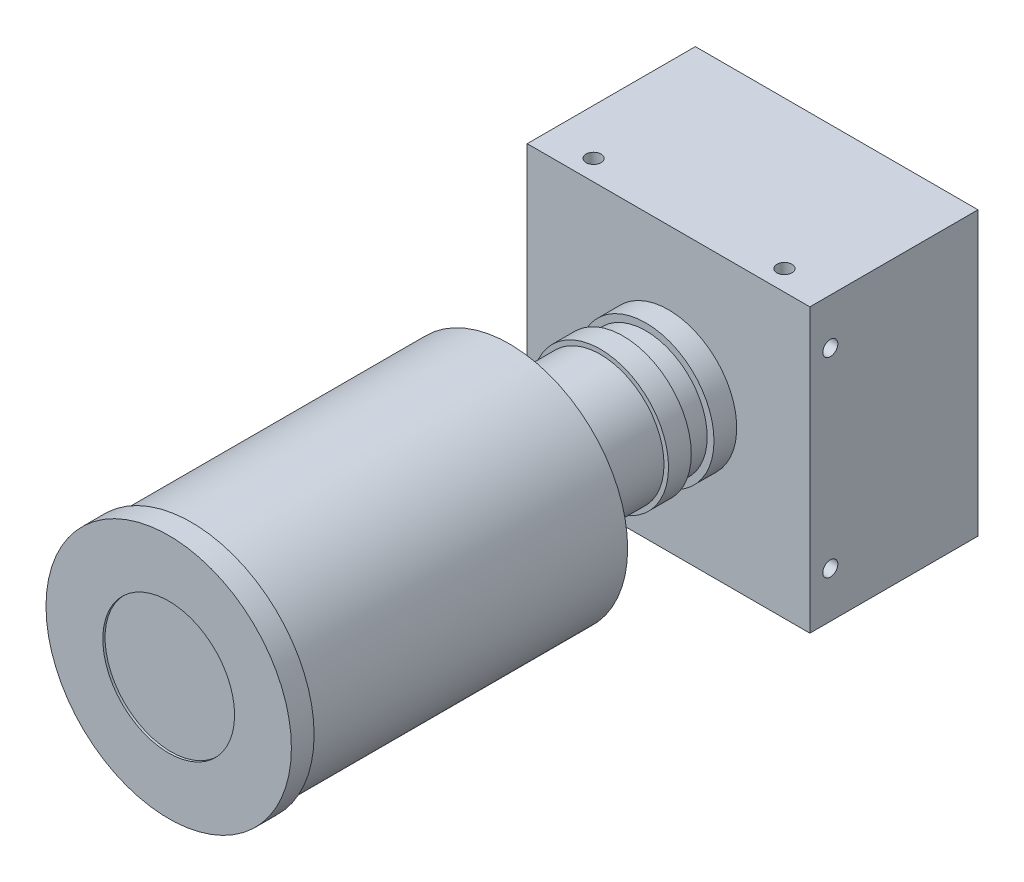
from build123d import *

# Parameters (mm, degrees)
SKETCH_1_W             = 62.2
SKETCH_1_H             = 62.2
EXTRUDE_1_DEPTH        = 37
SKETCH_2_R             = 15
EXTRUDE_2_DEPTH        = 5
SKETCH_3_R             = 13.5
EXTRUDE_3_DEPTH        = 5
SKETCH_4_R             = 15
EXTRUDE_4_DEPTH        = 5
SKETCH_5_R             = 14
EXTRUDE_5_DEPTH        = 20
SKETCH_6_R             = 26
EXTRUDE_6_DEPTH        = 70
SKETCH_7_R             = 27
EXTRUDE_7_DEPTH        = 5
SKETCH_8_R             = 14.5
CUT_EXTRUDE_1_DEPTH    = 0.5
SKETCH_9_R             = 4.987570285
SKETCH_9_R_2           = 3.46960963
EXTRUDE_8_DEPTH        = 7
SKETCH_10_W            = 8.223130645
SKETCH_10_H            = 5.124180357
CUT_EXTRUDE_2_DEPTH    = 3
HOLE_WIZARD_M4_1_D     = 3.3
HOLE_WIZARD_M4_1_DEPTH = 10.1
HOLE_WIZARD_M4_1_TIP   = 0.991420021
HOLE_WIZARD_M4_2_D     = 3.3
HOLE_WIZARD_M4_2_DEPTH = 10.1
HOLE_WIZARD_M4_2_TIP   = 0.991420021
HOLE_WIZARD_M4_3_D     = 3.3
HOLE_WIZARD_M4_3_DEPTH = 10.1
HOLE_WIZARD_M4_3_TIP   = 0.991420021
HOLE_WIZARD_M4_4_D     = 3.3
HOLE_WIZARD_M4_4_DEPTH = 10.1
HOLE_WIZARD_M4_4_TIP   = 0.991420021


with BuildPart() as part:
    # 草图1 → 凸台-拉伸1 (new body)
    with BuildSketch(Plane.XY):
        with Locations((31.1, 31.1)):
            Rectangle(SKETCH_1_W, SKETCH_1_H)
    extrude(amount=EXTRUDE_1_DEPTH)

    # 草图2 → 凸台-拉伸2 (add)
    with BuildSketch(Plane.XY.offset(37)):
        with Locations(Location((31.1, 31.1, 0), (0, 0, 180))):
            Circle(SKETCH_2_R)
    extrude(amount=EXTRUDE_2_DEPTH)

    # 草图3 → 凸台-拉伸3 (add)
    with BuildSketch(Plane.XY.offset(42)):
        with Locations((31.1, 31.1)):
            Circle(SKETCH_3_R)
    extrude(amount=EXTRUDE_3_DEPTH)

    # 草图4 → 凸台-拉伸4 (add)
    with BuildSketch(Plane.XY.offset(47)):
        with Locations(Location((31.1, 31.1, 0), (0, 0, 180))):
            Circle(SKETCH_4_R)
    extrude(amount=EXTRUDE_4_DEPTH)

    # 草图5 → 凸台-拉伸5 (add)
    with BuildSketch(Plane.XY.offset(52)):
        with Locations((31.1, 31.1)):
            Circle(SKETCH_5_R)
    extrude(amount=EXTRUDE_5_DEPTH)

    # 草图6 → 凸台-拉伸6 (add)
    with BuildSketch(Plane.XY.offset(72)):
        with Locations((31.1, 31.1)):
            Circle(SKETCH_6_R)
    extrude(amount=EXTRUDE_6_DEPTH)

    # 草图7 → 凸台-拉伸7 (add)
    with BuildSketch(Plane.XY.offset(142)):
        with Locations((31.1, 31.1)):
            Circle(SKETCH_7_R)
    extrude(amount=EXTRUDE_7_DEPTH)

    # 草图8 → 切除-拉伸1 (cut)
    with BuildSketch(Plane.XY.offset(147)):
        with Locations((31.1, 31.1)):
            Circle(SKETCH_8_R)
    extrude(amount=-CUT_EXTRUDE_1_DEPTH, mode=Mode.SUBTRACT)

    # 草图9 → 凸台-拉伸8 (add)
    with BuildSketch(Plane(origin=(0, 0, 0), x_dir=(-1, 0, 0), z_dir=(0, 0, -1))):
        with Locations((-16.576254003, 47.30330958)):
            Circle(SKETCH_9_R)
        with Locations((-16.576254003, 47.30330958)):
            Circle(SKETCH_9_R_2, mode=Mode.SUBTRACT)
    extrude(amount=EXTRUDE_8_DEPTH)

    # 草图10 → 切除-拉伸2 (cut)
    with BuildSketch(Plane(origin=(0, 0, 0), x_dir=(-1, 0, 0), z_dir=(0, 0, -1))):
        with Locations((-20.516916702, 15.688590304)):
            Rectangle(SKETCH_10_W, SKETCH_10_H)
    extrude(amount=-CUT_EXTRUDE_2_DEPTH, mode=Mode.SUBTRACT)

    # M4 螺纹孔1
    with Locations(Plane(origin=(0, 62.2, 0), x_dir=(-1, 0, 0), z_dir=(0, 1, 0))):
        with Locations((-10.1, 32.5), (-52.1, 32.5)):
            Hole(HOLE_WIZARD_M4_1_D / 2, depth=HOLE_WIZARD_M4_1_DEPTH)
            with Locations((0, 0, -(HOLE_WIZARD_M4_1_DEPTH + HOLE_WIZARD_M4_1_TIP / 2))):  # 118° drill point
                Cone(0, HOLE_WIZARD_M4_1_D / 2, HOLE_WIZARD_M4_1_TIP, mode=Mode.SUBTRACT)

    # M4 螺纹孔2
    with Locations(Plane(origin=(62.2, 0, 0), x_dir=(0, 0, -1), z_dir=(1, 0, 0))):
        with Locations((-32.5, 10.1), (-32.5, 52.1)):
            Hole(HOLE_WIZARD_M4_2_D / 2, depth=HOLE_WIZARD_M4_2_DEPTH)
            with Locations((0, 0, -(HOLE_WIZARD_M4_2_DEPTH + HOLE_WIZARD_M4_2_TIP / 2))):  # 118° drill point
                Cone(0, HOLE_WIZARD_M4_2_D / 2, HOLE_WIZARD_M4_2_TIP, mode=Mode.SUBTRACT)

    # M4 螺纹孔3
    with Locations(Plane.XZ):
        with Locations((10.1, 32.5), (52.1, 32.5)):
            Hole(HOLE_WIZARD_M4_3_D / 2, depth=HOLE_WIZARD_M4_3_DEPTH)
            with Locations((0, 0, -(HOLE_WIZARD_M4_3_DEPTH + HOLE_WIZARD_M4_3_TIP / 2))):  # 118° drill point
                Cone(0, HOLE_WIZARD_M4_3_D / 2, HOLE_WIZARD_M4_3_TIP, mode=Mode.SUBTRACT)

    # M4 螺纹孔4
    with Locations(Plane.ZY):
        with Locations((32.5, 52.1), (32.5, 10.1)):
            Hole(HOLE_WIZARD_M4_4_D / 2, depth=HOLE_WIZARD_M4_4_DEPTH)
            with Locations((0, 0, -(HOLE_WIZARD_M4_4_DEPTH + HOLE_WIZARD_M4_4_TIP / 2))):  # 118° drill point
                Cone(0, HOLE_WIZARD_M4_4_D / 2, HOLE_WIZARD_M4_4_TIP, mode=Mode.SUBTRACT)


solid = part.part
